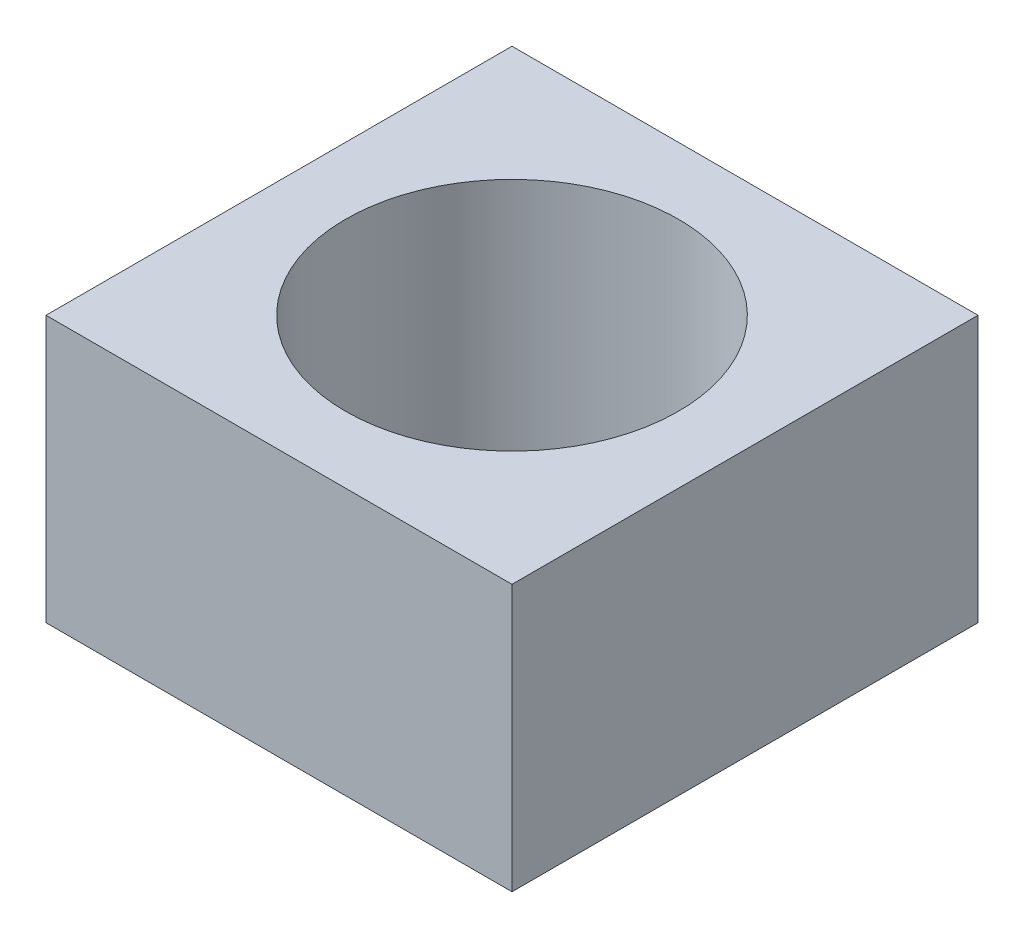
from build123d import *

# Parameters (mm, degrees)
SKETCH_1_W      = 7
SKETCH_1_H      = 7
SKETCH_1_R      = 2.5
EXTRUDE_1_DEPTH = 4


with BuildPart() as part:
    # 草图1 → 凸台-拉伸1 (new body)
    with BuildSketch(Plane(origin=(0, 0, 0), x_dir=(1, 0, 0), z_dir=(0, 1, 0))):
        with Locations((3.5, 3.5)):
            Rectangle(SKETCH_1_W, SKETCH_1_H)
        with Locations(Location((3.5, 3.5, 0), (0, 0, 270))):
            Circle(SKETCH_1_R, mode=Mode.SUBTRACT)
    extrude(amount=EXTRUDE_1_DEPTH)


solid = part.part
